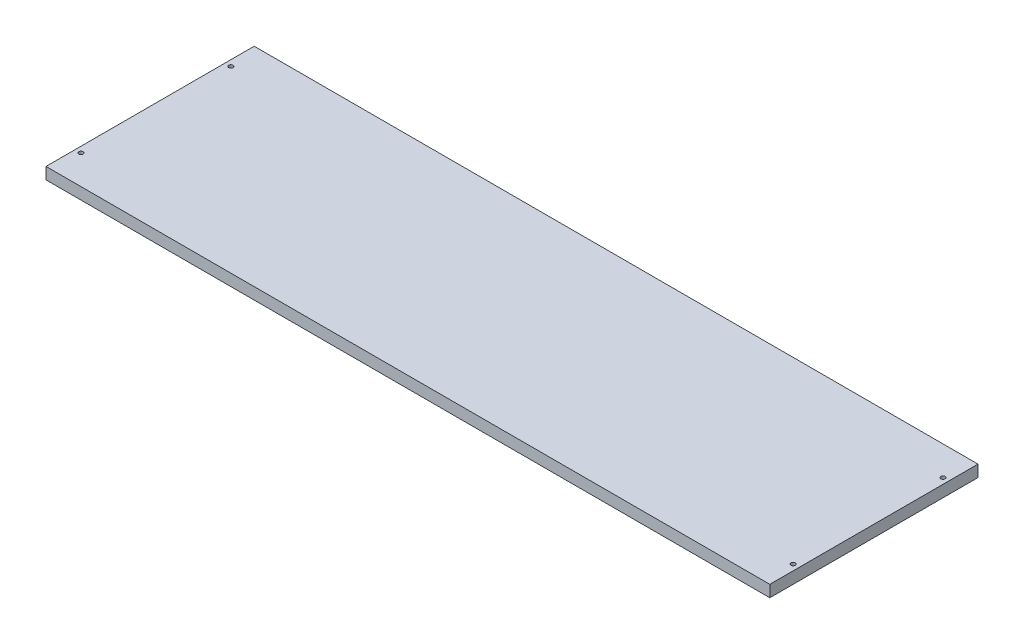
from build123d import *

# Parameters (mm, degrees)
SKETCH_1_W      = 372
SKETCH_1_H      = 107
SKETCH_1_R      = 1.1
EXTRUDE_1_DEPTH = 6


with BuildPart() as part:
    # Эскиз1 → Бобышка-Вытянуть1 (new body)
    with BuildSketch(Plane(origin=(0, 0, 0), x_dir=(1, 0, 0), z_dir=(0, 1, 0))):
        with Locations((-186, 53.5)):
            Rectangle(SKETCH_1_W, SKETCH_1_H)
        with Locations(Location((-369, 92, 0), (0, 0, 270))):
            Circle(SKETCH_1_R, mode=Mode.SUBTRACT)
        with Locations(Location((-369, 15, 0), (0, 0, 270))):
            Circle(SKETCH_1_R, mode=Mode.SUBTRACT)
        with Locations(Location((-3, 92, 0), (0, 0, 270))):
            Circle(SKETCH_1_R, mode=Mode.SUBTRACT)
        with Locations(Location((-3, 15, 0), (0, 0, 270))):
            Circle(SKETCH_1_R, mode=Mode.SUBTRACT)
    extrude(amount=EXTRUDE_1_DEPTH)


solid = part.part
